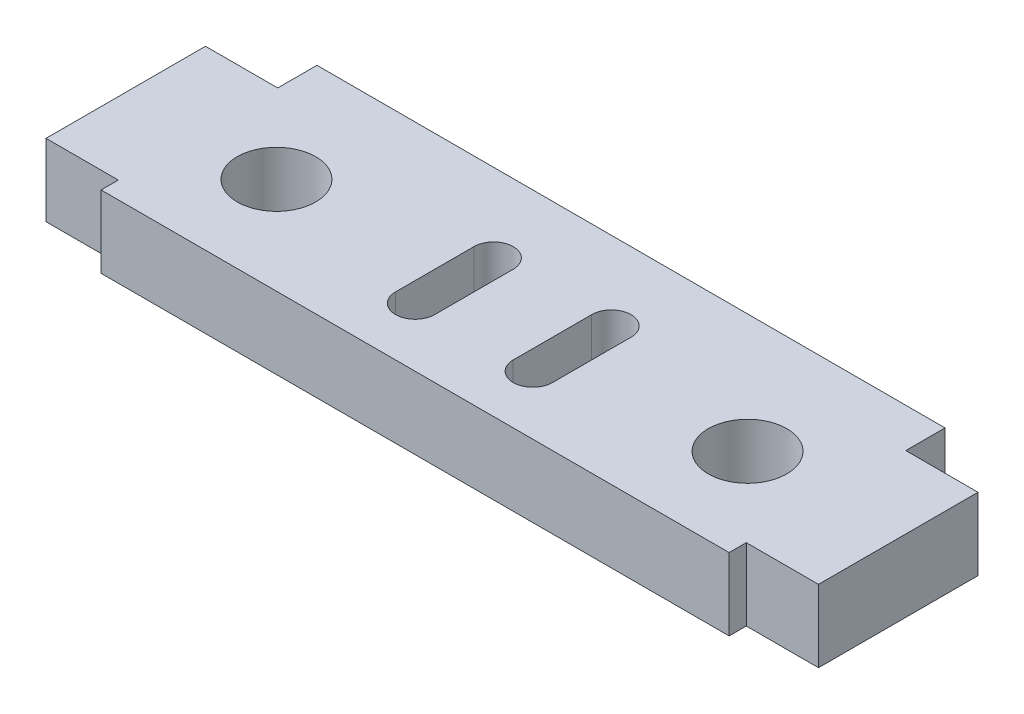
from build123d import *

# Parameters (mm, degrees)
BOSS_EXTRUDE1_DEPTH = 5.842
SKETCH2_R           = 3.175
CUT_EXTRUDE1_DEPTH  = 33.78403476
CUT_EXTRUDE3_DEPTH  = 33.78403476
SKETCH5_W           = 50.8
SKETCH5_H           = 1.5875
BOSS_EXTRUDE2_DEPTH = 5.842


with BuildPart() as part:
    # Sketch1 → Boss-Extrude1 (new body)
    with BuildSketch(Plane(origin=(0, 0, 0), x_dir=(1, 0, 0), z_dir=(0, 1, 0))):
        Polygon((31.242, -6.450000054), (25.4, -6.450000054), (25.4, -7.837499946), (-25.4, -7.837499946), (-25.4, -6.450000054), (-31.242, -6.450000054), (-31.242, 6.450000054), (-25.4, 6.450000054), (-25.4, 8.037500054), (25.4, 8.037500054), (25.4, 6.450000054), (31.242, 6.450000054), align=None)
    extrude(amount=BOSS_EXTRUDE1_DEPTH)

    # Sketch2 → Cut-Extrude1 (cut, through all)
    with BuildSketch(Plane(origin=(0, 5.842, 0), x_dir=(1, 0, 0), z_dir=(0, 1, 0))):
        with Locations(Location((-19.05, 0, 0), (0, 0, 270))):
            Circle(SKETCH2_R)
        with Locations(Location((19.05, 0, 0), (0, 0, 90))):
            Circle(SKETCH2_R)
    extrude(amount=-CUT_EXTRUDE1_DEPTH, mode=Mode.SUBTRACT)

    # Sketch4 → Cut-Extrude3 (cut, through all)
    with BuildSketch(Plane(origin=(0, 0, 0), x_dir=(-1, 0, 0), z_dir=(0, -1, 0))):
        with BuildLine():
            Line((3.175, -3.074999946), (3.175, 3.275000054))
            ThreePointArc((3.175, 3.275000054), (4.7625, 4.862500054), (6.35, 3.275000054))
            Line((6.35, 3.275000054), (6.35, -3.074999946))
            ThreePointArc((6.35, -3.074999946), (4.7625, -4.662499946), (3.175, -3.074999946))
        make_face()
        with BuildLine():
            Line((-3.175, -3.074999946), (-3.175, 3.275000054))
            ThreePointArc((-3.175, 3.275000054), (-4.7625, 4.862500054), (-6.35, 3.275000054))
            Line((-6.35, 3.275000054), (-6.35, -3.074999946))
            ThreePointArc((-6.35, -3.074999946), (-4.7625, -4.662499946), (-3.175, -3.074999946))
        make_face()
    extrude(amount=-CUT_EXTRUDE3_DEPTH, mode=Mode.SUBTRACT)

    # Sketch5 → Boss-Extrude2 (add)
    with BuildSketch(Plane(origin=(0, 0, 0), x_dir=(-1, 0, 0), z_dir=(0, -1, 0))):
        with Locations((0, 8.831250054)):
            Rectangle(SKETCH5_W, SKETCH5_H)
    extrude(amount=-BOSS_EXTRUDE2_DEPTH)


solid = part.part
